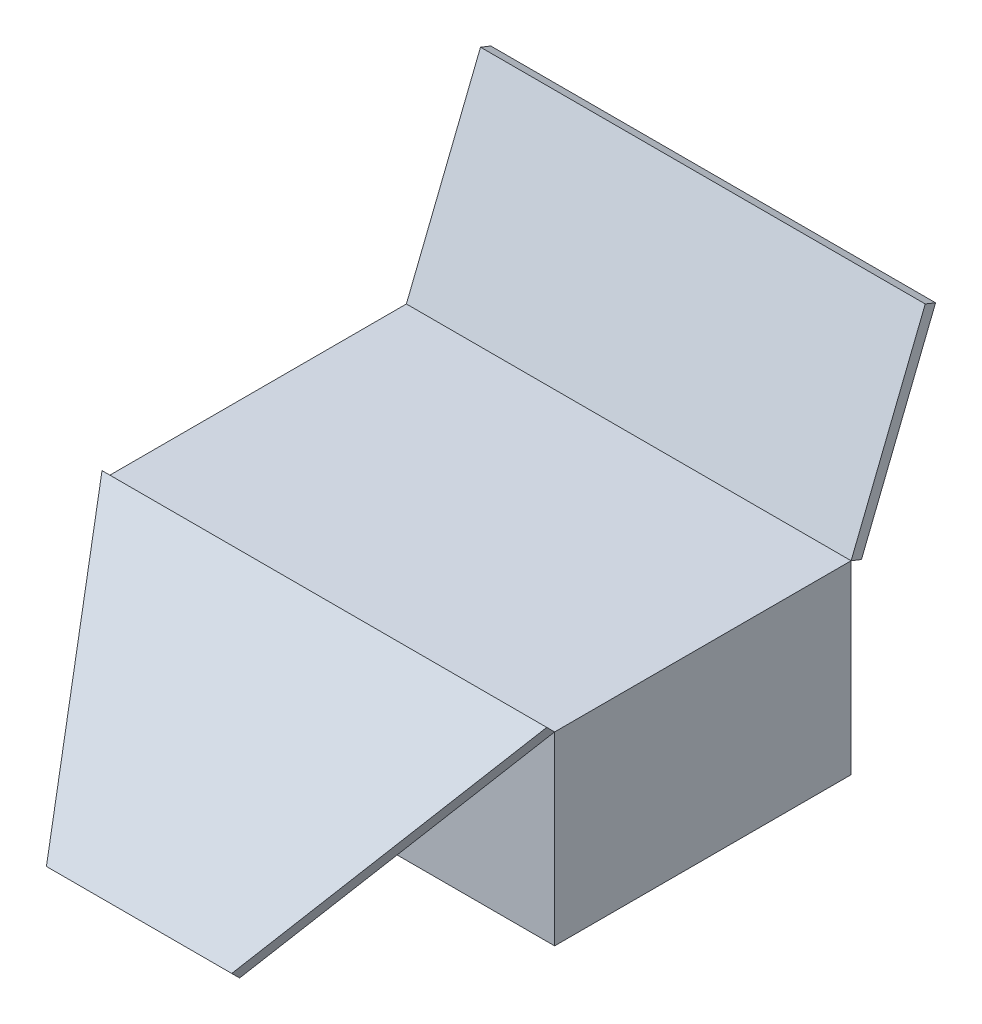
from build123d import *

# Parameters (mm, degrees)
SKETCH1_W           = 120
SKETCH1_H           = 80
BOSS_EXTRUDE3_DEPTH = 50
SKETCH4_W           = 120
SKETCH4_H           = 53.851648072
BOSS_EXTRUDE4_DEPTH = 3
BOSS_EXTRUDE5_DEPTH = 3
SKETCH7_W           = 25
SKETCH7_H           = 60
CUT_EXTRUDE1_DEPTH  = 45


with BuildPart() as part:
    # Sketch1 → Boss-Extrude3 (new body)
    with BuildSketch(Plane(origin=(0, 0, 0), x_dir=(1, 0, 0), z_dir=(0, 1, 0))):
        with Locations((3.125, 5)):
            Rectangle(SKETCH1_W, SKETCH1_H)
    extrude(amount=BOSS_EXTRUDE3_DEPTH)

    # Sketch7 → Cut-Extrude1 (cut)
    with BuildSketch(Plane.XZ):
        with Locations((3.125, -5)):
            Rectangle(SKETCH7_W, SKETCH7_H)
    extrude(amount=-CUT_EXTRUDE1_DEPTH, mode=Mode.SUBTRACT)


with BuildPart() as body_2:
    # Sketch4 → Boss-Extrude4 (new body)
    with BuildSketch(Plane(origin=(0, -8.620689655, -21.551724138), x_dir=(-1, 0, 0), z_dir=(0, -0.3713906763541038, -0.9284766908852594))):
        with Locations((-3.125, 90.062239016)):
            Rectangle(SKETCH4_W, SKETCH4_H)
    extrude(amount=BOSS_EXTRUDE4_DEPTH)


with BuildPart() as body_3:
    # Sketch6 → Boss-Extrude5 (new body)
    with BuildSketch(Plane(origin=(0, 42.5, 42.5), x_dir=(1, 0, 0), z_dir=(0, 0.7071067811865475, 0.7071067811865477))):
        Polygon((-21.875, -60.104076401), (-56.875, 10.606601718), (63.125, 10.606601718), (28.125, -60.104076401), align=None)
    extrude(amount=BOSS_EXTRUDE5_DEPTH)


solid = Compound([part.part, body_2.part, body_3.part])
